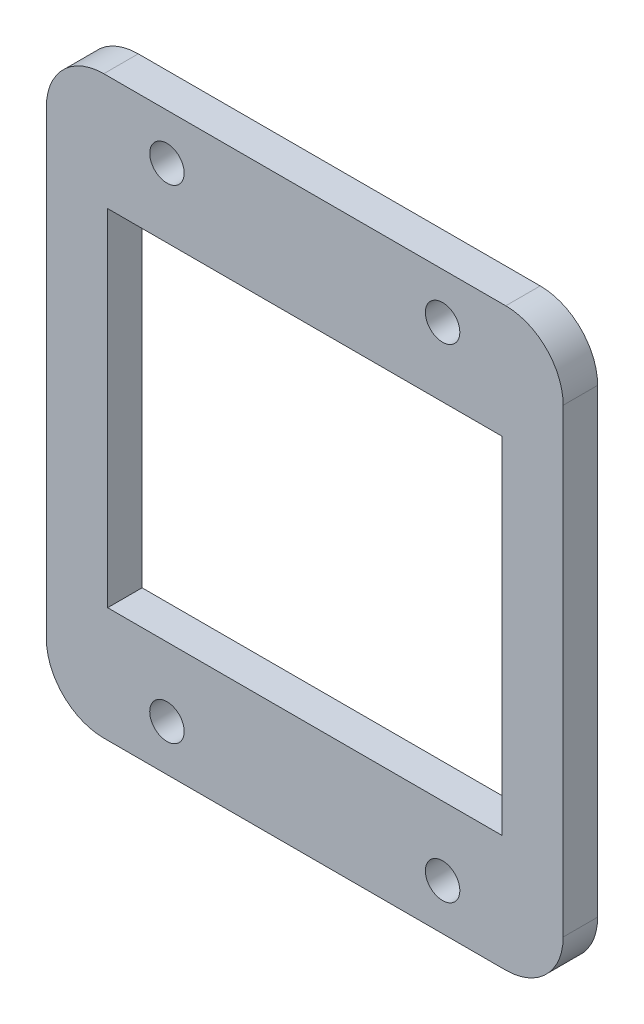
from build123d import *

# Parameters (mm, degrees)
SKETCH_1_W      = 45
SKETCH_1_H      = 50.1
SKETCH_1_R      = 1.5
SKETCH_1_W_2    = 34.330352234
SKETCH_1_H_2    = 30.1
EXTRUDE_1_DEPTH = 3
FILLET_1_R      = 5


with BuildPart() as part:
    # 草图1 → 凸台-拉伸1 (new body)
    with BuildSketch(Plane.XY):
        with Locations((22.5, 25.05)):
            Rectangle(SKETCH_1_W, SKETCH_1_H)
        with Locations((10.5, 46.1)):
            Circle(SKETCH_1_R, mode=Mode.SUBTRACT)
        with Locations((34.5, 46.1)):
            Circle(SKETCH_1_R, mode=Mode.SUBTRACT)
        with Locations(Location((34.5, 4, 0), (0, 0, 180))):
            Circle(SKETCH_1_R, mode=Mode.SUBTRACT)
        with Locations(Location((10.5, 4, 0), (0, 0, 180))):
            Circle(SKETCH_1_R, mode=Mode.SUBTRACT)
        with Locations((22.5, 25.05)):
            Rectangle(SKETCH_1_W_2, SKETCH_1_H_2, mode=Mode.SUBTRACT)
    extrude(amount=EXTRUDE_1_DEPTH)

    # 圆角1
    fillet_1_edges = [part.edges().sort_by_distance(p)[0] for p in [
        (0, 50.1, 1.5),
        (45, 50.1, 1.5),
        (45, 0, 1.5),
        (0, 0, 1.5),
    ]]
    fillet(fillet_1_edges, radius=FILLET_1_R)


solid = part.part
